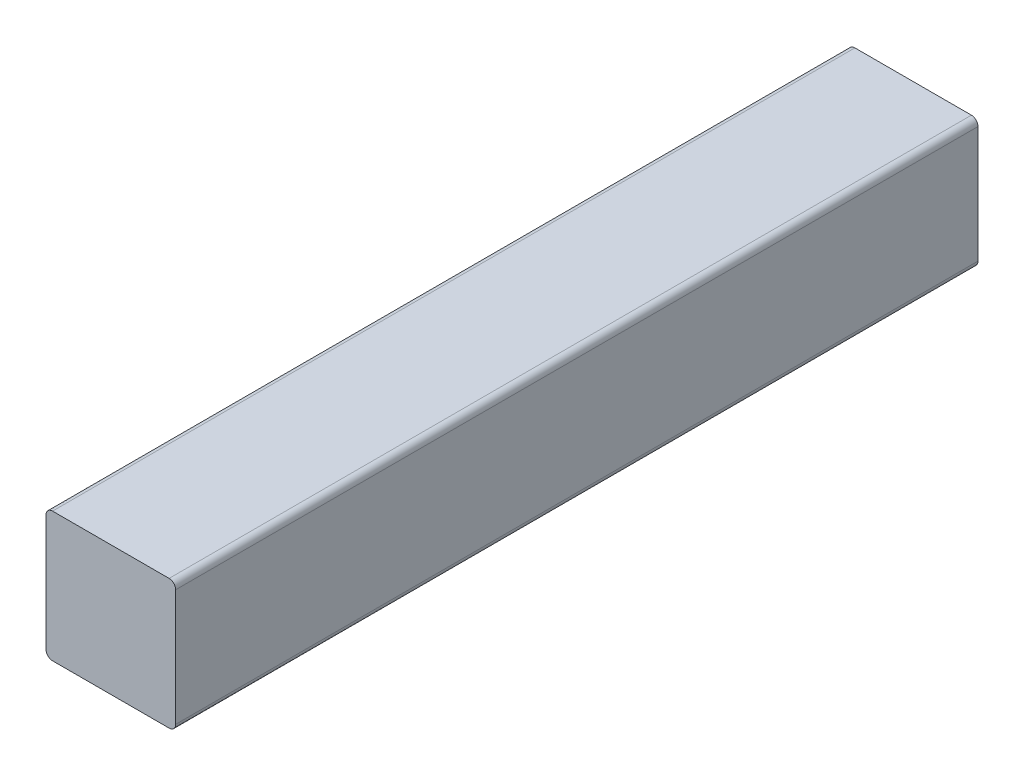
from build123d import *

# Parameters (mm, degrees)
SKETCH1_W           = 20.066
SKETCH1_H           = 20.066
BOSS_EXTRUDE1_DEPTH = 62.0776
FILLET1_R           = 1.016


with BuildPart() as part:
    # Sketch1 → Boss-Extrude1 (new, symmetric)
    with BuildSketch(Plane.XY):
        Rectangle(SKETCH1_W, SKETCH1_H)
    extrude(amount=BOSS_EXTRUDE1_DEPTH, both=True)

    # Fillet1
    fillet1_edges = [part.edges().sort_by_distance(p)[0] for p in [
        (10.033, -10.033, 0),
        (-10.033, -10.033, 0),
        (-10.033, 10.033, 0),
        (10.033, 10.033, 0),
    ]]
    fillet(fillet1_edges, radius=FILLET1_R)


solid = part.part
